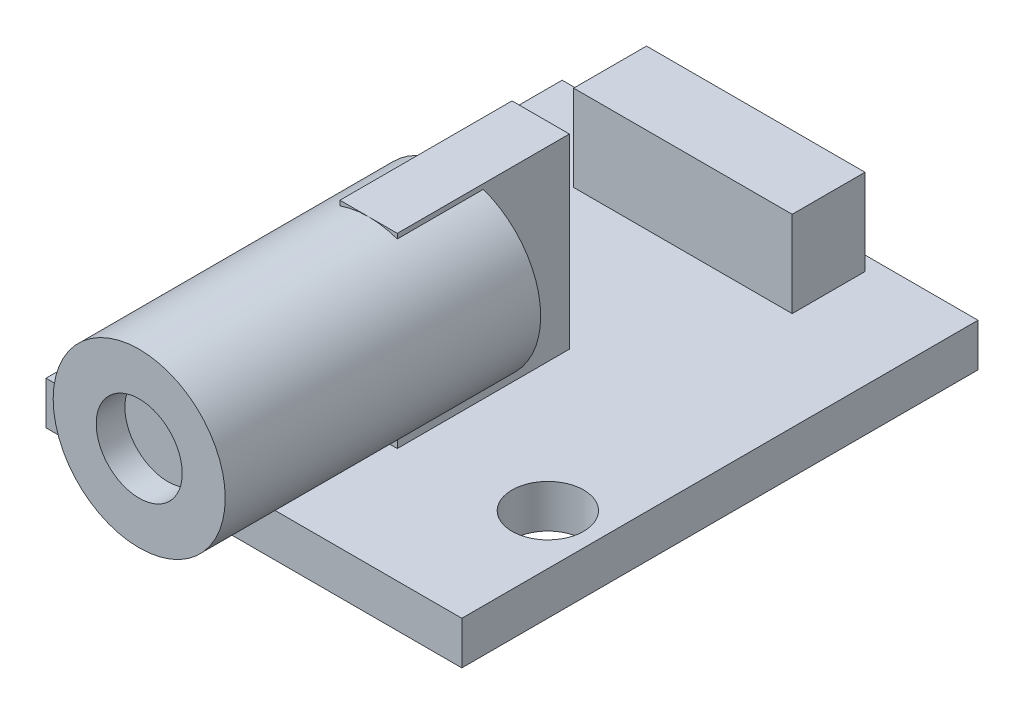
from build123d import *

# Parameters (mm, degrees)
SKETCH1_W                = 14.5
SKETCH1_H                = 18
BOSS_EXTRUDE1_DEPTH      = 1.5
BOSS_EXTRUDE2_DEPTH      = 4
BOSS_EXTRUDE2_DEPTH_BACK = 7
SKETCH2_R                = 3
SKETCH3_R                = 1.5
CUT_EXTRUDE1_DEPTH       = 1
SKETCH4_W                = 2
SKETCH4_H                = 6
BOSS_EXTRUDE3_DEPTH      = 6.5
SKETCH5_W                = 7.62
SKETCH5_H                = 2.54
BOSS_EXTRUDE4_DEPTH      = 3
SKETCH7_R                = 1.25
CUT_EXTRUDE2_DEPTH       = 17.242305871


with BuildPart() as part:
    # Sketch1 → Boss-Extrude1 (new body)
    with BuildSketch(Plane(origin=(0, 0, 0), x_dir=(1, 0, 0), z_dir=(0, 1, 0))):
        Rectangle(SKETCH1_W, SKETCH1_H)
    extrude(amount=BOSS_EXTRUDE1_DEPTH)



with BuildPart() as body_2:
    # Sketch2 → Boss-Extrude2 (new, two sides: drawn at the far end of the back side and taken through both)
    with BuildSketch(Plane.XY.offset(9).offset(-BOSS_EXTRUDE2_DEPTH_BACK)):
        with Locations((0, 5)):
            Circle(SKETCH2_R)
    extrude(amount=BOSS_EXTRUDE2_DEPTH + BOSS_EXTRUDE2_DEPTH_BACK)

    # Sketch3 → Cut-Extrude1 (cut)
    with BuildSketch(Plane.XY.offset(13)):
        with Locations((0, 5)):
            Circle(SKETCH3_R)
    extrude(amount=-CUT_EXTRUDE1_DEPTH, mode=Mode.SUBTRACT)


with BuildPart() as part_1:
    add(part.part)

    add(body_2.part)  # Boss-Extrude3 merges body 2
    # Sketch4 → Boss-Extrude3 (add)
    with BuildSketch(Plane(origin=(0, 1.5, 0), x_dir=(1, 0, 0), z_dir=(0, 1, 0))):
        with Locations((0, -2)):
            Rectangle(SKETCH4_W, SKETCH4_H)
    extrude(amount=BOSS_EXTRUDE3_DEPTH)

    # Sketch5 → Boss-Extrude4 (add)
    with BuildSketch(Plane(origin=(0, 1.5, 0), x_dir=(1, 0, 0), z_dir=(0, 1, 0))):
        with Locations((0, 7.23)):
            Rectangle(SKETCH5_W, SKETCH5_H)
    extrude(amount=BOSS_EXTRUDE4_DEPTH)

    # Sketch7 → Cut-Extrude2 (cut, through all)
    with BuildSketch(Plane(origin=(0, 1.5, 0), x_dir=(1, 0, 0), z_dir=(0, 1, 0))):
        with Locations(Location((-5.5, -4.25, 0), (0, 0, 270))):
            Circle(SKETCH7_R)
        with Locations(Location((5.5, -4.25, 0), (0, 0, 90))):
            Circle(SKETCH7_R)
    extrude(amount=-CUT_EXTRUDE2_DEPTH, mode=Mode.SUBTRACT)


solid = part_1.part
